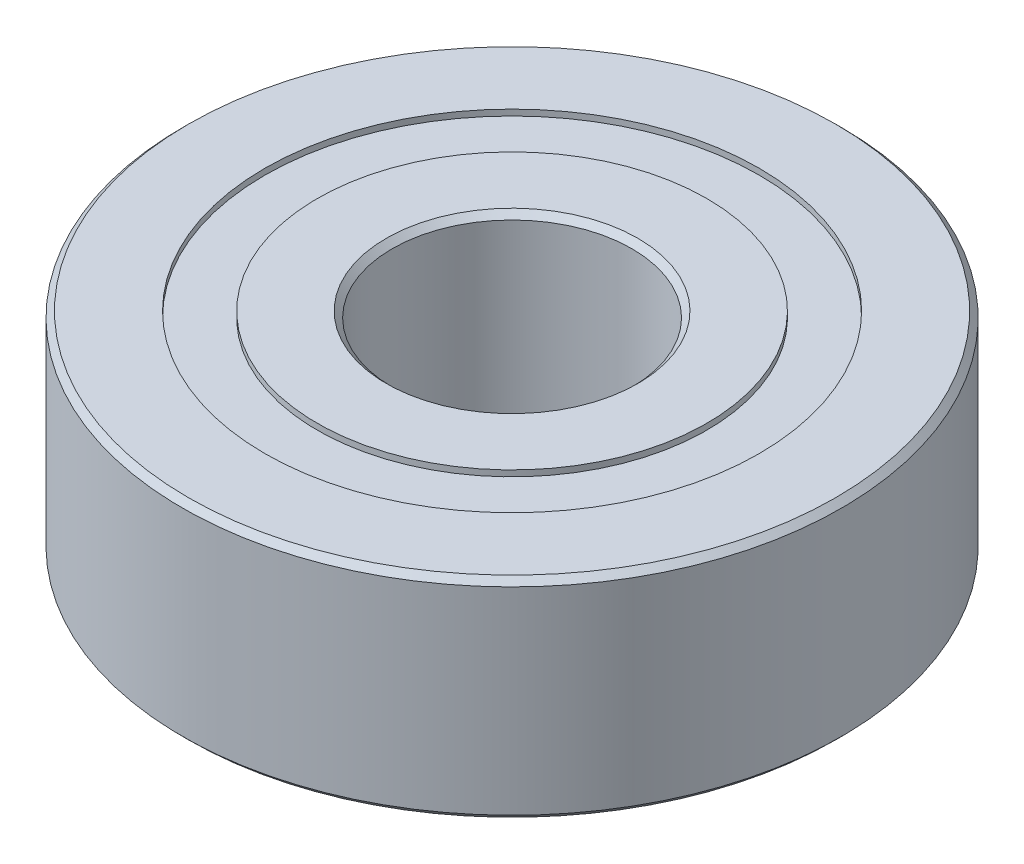
from build123d import *


with BuildPart() as part:
    # Sketch1 → Revolve1 (revolve)
    with BuildSketch(Plane.XY, mode=Mode.PRIVATE) as revolve1_sk:
        Polygon((11, 6.8), (10.8, 7), (8.25, 7), (8.25, 6.8), (6.5, 6.8), (6.5, 7), (4.2, 7), (4, 6.8), (4, 0.2), (4.2, 0), (6.5, 0), (6.5, 0.2), (8.25, 0.2), (8.25, 0), (10.8, 0), (11, 0.2), align=None)
    revolve(revolve1_sk.sketch.rotate(Axis((0, 7, 0), (0, -1, 0)), 270), axis=Axis((0, 7, 0), (0, -1, 0)))


solid = part.part
